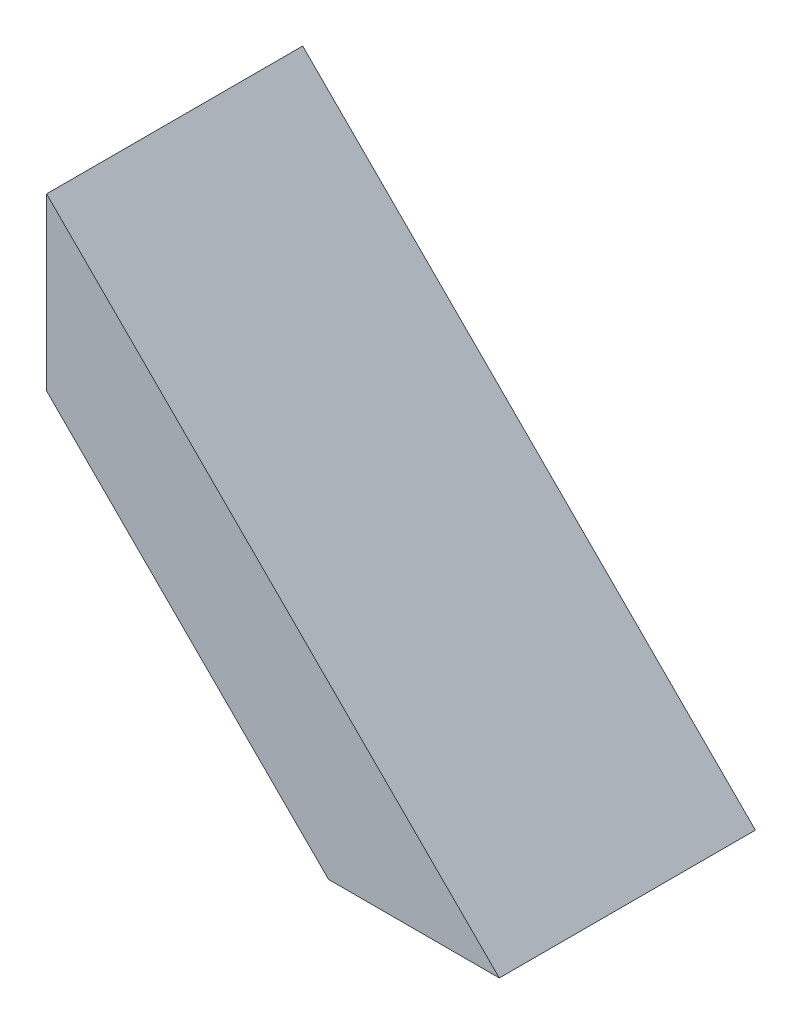
from build123d import *

# Parameters (mm, degrees)
BOSS_EXTRUDE1_DEPTH = 6


with BuildPart() as part:
    # Sketch1 → Boss-Extrude1 (new body)
    with BuildSketch(Plane.XY):
        Polygon((-7.191114458, -0.277585029), (-7.191114458, -4.277585029), (-0.58451274, -10.884186747), (3.41548726, -10.884186747), align=None)
    extrude(amount=BOSS_EXTRUDE1_DEPTH)


solid = part.part
